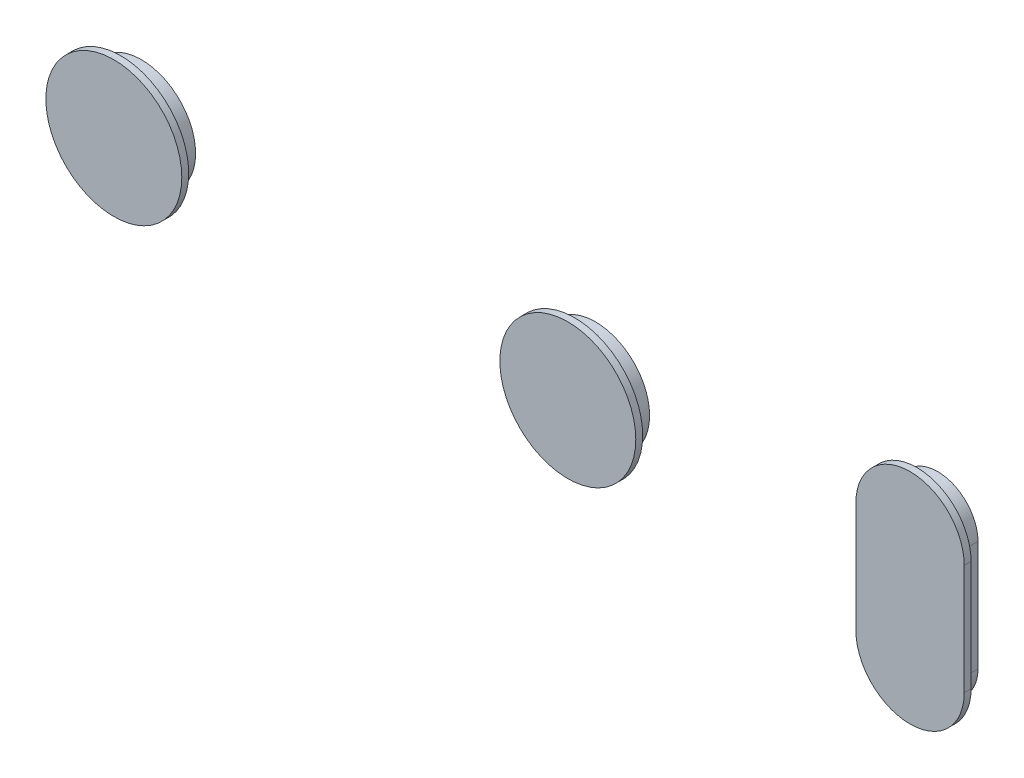
from build123d import *

# Parameters (mm, degrees)
SKETCH1_R             = 7.85
BOSS_EXTRUDE1_DEPTH   = 3
BOSS_EXTRUDE1_2_DEPTH = 3
BOSS_EXTRUDE1_3_DEPTH = 3
SKETCH2_R             = 9.85
BOSS_EXTRUDE2_DEPTH   = 1


with BuildPart() as part:
    # Sketch1 → Boss-Extrude1 (new body)
    with BuildSketch(Plane.XY):
        with Locations((198.291338583, 289.752755906)):
            Circle(SKETCH1_R)
    extrude(amount=-BOSS_EXTRUDE1_DEPTH)



with BuildPart() as body_2:
    # Sketch1 → Boss-Extrude1 2 (new body)
    with BuildSketch(Plane.XY):
        with Locations((264.091338583, 289.752755906)):
            Circle(SKETCH1_R)
    extrude(amount=-BOSS_EXTRUDE1_2_DEPTH)


with BuildPart() as body_3:
    # Sketch1 → Boss-Extrude1 3 (new body)
    with BuildSketch(Plane.XY):
        with BuildLine():
            Line((307.841338583, 297.752755906), (307.841338583, 281.752755906))
            ThreePointArc((307.841338583, 281.752755906), (313.691338583, 275.902755906), (319.541338583, 281.752755906))
            Line((319.541338583, 281.752755906), (319.541338583, 297.752755906))
            ThreePointArc((319.541338583, 297.752755906), (313.691338583, 303.602755906), (307.841338583, 297.752755906))
        make_face()
    extrude(amount=-BOSS_EXTRUDE1_3_DEPTH)


with BuildPart() as part_1:
    add(part.part)

    add(body_2.part)  # Boss-Extrude2 merges body 2

    add(body_3.part)  # Boss-Extrude2 merges body 3
    # Sketch2 → Boss-Extrude2 (add)
    with BuildSketch(Plane.XY):
        with Locations((198.291338583, 289.752755906)):
            Circle(SKETCH2_R)
        with Locations((264.091338583, 289.752755906)):
            Circle(SKETCH2_R)
        with BuildLine():
            Line((305.841338583, 297.752755906), (305.841338583, 281.752755906))
            ThreePointArc((305.841338583, 281.752755906), (313.691338583, 273.902755906), (321.541338583, 281.752755906))
            Line((321.541338583, 281.752755906), (321.541338583, 297.752755906))
            ThreePointArc((321.541338583, 297.752755906), (313.691338583, 305.602755906), (305.841338583, 297.752755906))
        make_face()
    extrude(amount=BOSS_EXTRUDE2_DEPTH)


solid = part_1.part
